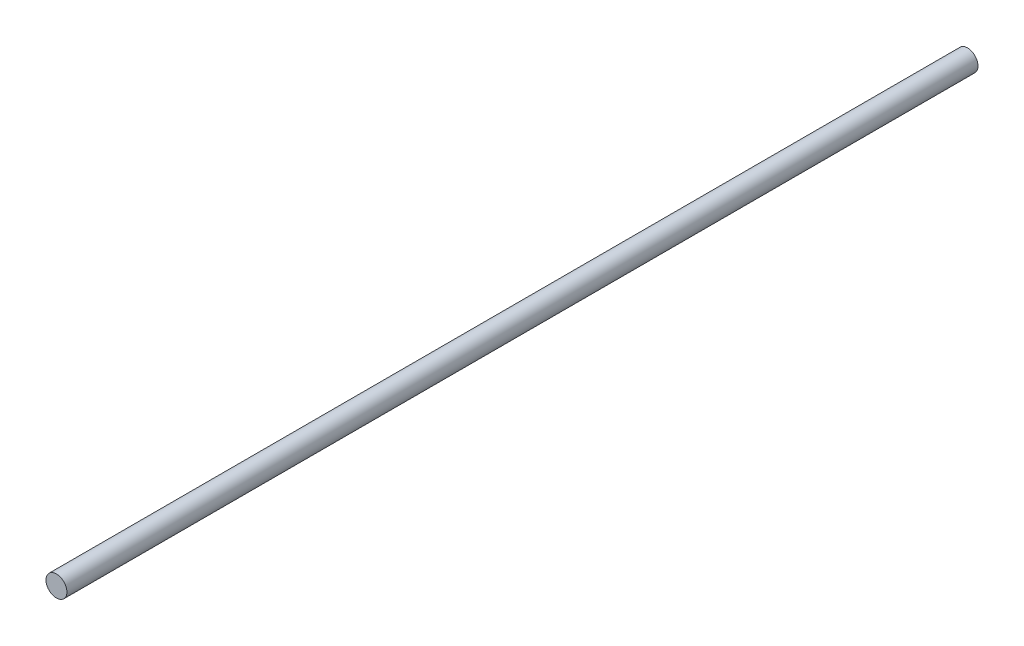
from build123d import *

# Parameters (mm, degrees)
SKETCH1_R           = 6
BOSS_EXTRUDE2_DEPTH = 261.25


with BuildPart() as part:
    # Sketch1 → Boss-Extrude2 (new, symmetric)
    with BuildSketch(Plane.XY):
        Circle(SKETCH1_R)
    extrude(amount=BOSS_EXTRUDE2_DEPTH, both=True)


solid = part.part
